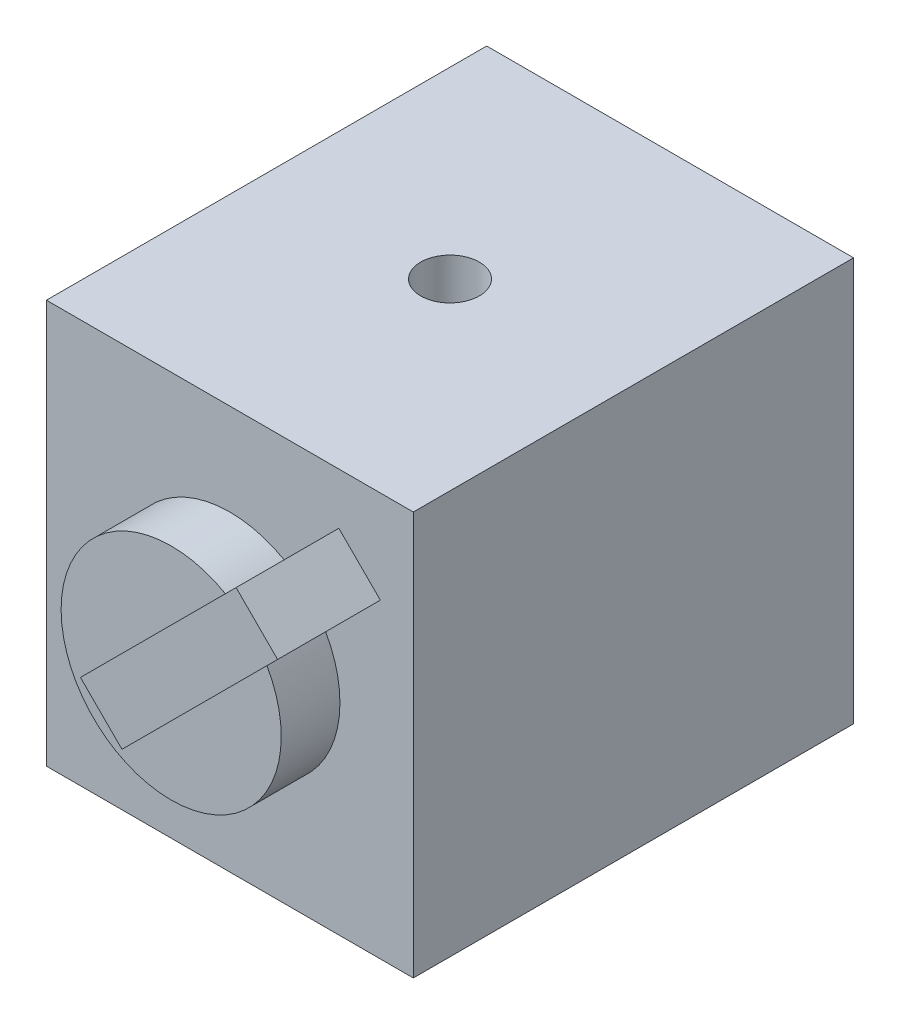
from build123d import *

# Parameters (mm, degrees)
SKETCH_1_W                  = 50
SKETCH_1_H                  = 55
EXTRUDE_1_DEPTH             = 30
SKETCH_2_R                  = 15
EXTRUDE_2_DEPTH             = 8
EXTRUDE_3_DEPTH             = 6
EXTRUDE_3_DIRECTION_2_REACH = 79.494
SKETCH_4_R                  = 4
CUT_EXTRUDE_1_DEPTH         = 6


with BuildPart() as part:
    # 草图1 → 凸台-拉伸1 (new, symmetric)
    with BuildSketch(Plane.XY):
        Rectangle(SKETCH_1_W, SKETCH_1_H)
    extrude(amount=EXTRUDE_1_DEPTH, both=True)

    # 草图2 → 凸台-拉伸2 (add)
    with BuildSketch(Plane.XY.offset(30)):
        Circle(SKETCH_2_R)
    extrude(amount=EXTRUDE_2_DEPTH)

    # 草图3 → 凸台-拉伸3 (add)
    with BuildSketch(Plane.XY.offset(38)):
        Polygon((14.849242405, 20.506096654), (-6.363961031, -0.707106781), (-0.707106781, -6.363961031), (20.506096654, 14.849242405), align=None)
    extrude(amount=EXTRUDE_3_DEPTH)

    # 草图3 → 凸台-拉伸3 direction 2 (add, up to next)
    with BuildSketch(Plane.XY.offset(38), mode=Mode.PRIVATE) as extrude_3_direction_2_sk1:
        Polygon((14.849242405, 20.506096654), (-6.363961031, -0.707106781), (-0.707106781, -6.363961031), (20.506096654, 14.849242405), align=None)
    extrude_3_direction_2_tool1 = extrude(extrude_3_direction_2_sk1.sketch, amount=-EXTRUDE_3_DIRECTION_2_REACH, mode=Mode.PRIVATE) - part.part
    add(extrude_3_direction_2_tool1.solids().sort_by_distance((7.071068, 7.071068, 38))[0])

    # 草图4 → 切除-拉伸1 (cut)
    with BuildSketch(Plane(origin=(0, 27.5, 0), x_dir=(1, 0, 0), z_dir=(0, 1, 0))):
        with Locations(Location((0, 0, 0), (0, 0, 180))):
            Circle(SKETCH_4_R)
    extrude(amount=-CUT_EXTRUDE_1_DEPTH, mode=Mode.SUBTRACT)


solid = part.part
